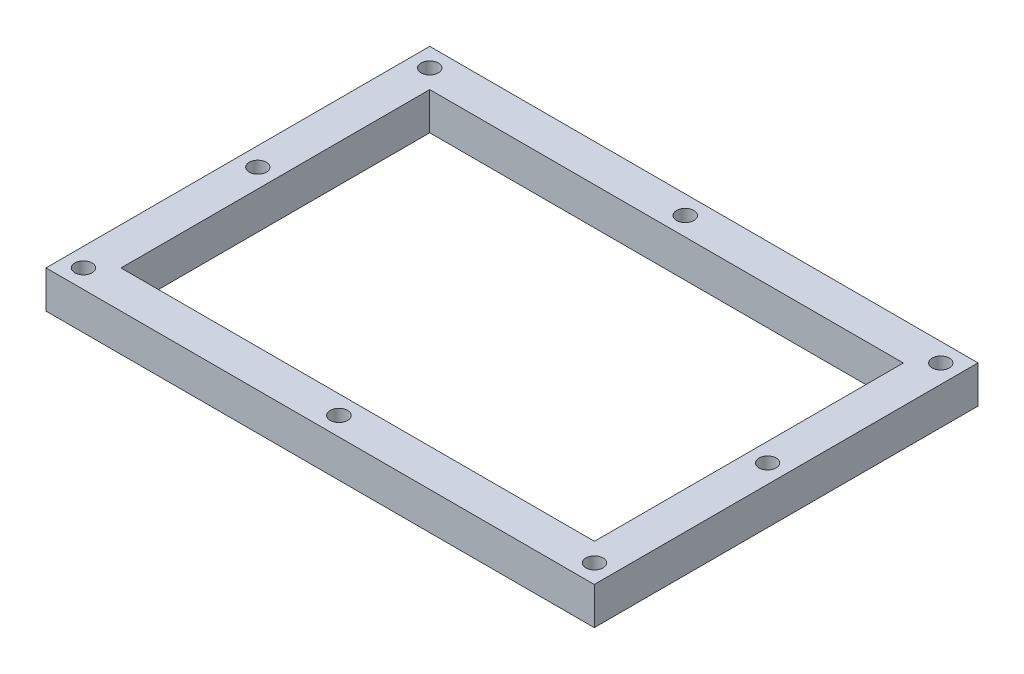
from build123d import *

# Parameters (mm, degrees)
SKETCH_1_W      = 146.451560669
SKETCH_1_H      = 102.5
SKETCH_1_R      = 2.329290182
SKETCH_1_R_2    = 2.3
EXTRUDE_1_DEPTH = 10


with BuildPart() as part:
    # Эскиз1 → Бобышка-Вытянуть1 (new body)
    with BuildSketch(Plane(origin=(0, 236.195974268, 0), x_dir=(1, 0, 0), z_dir=(0, 1, 0))):
        with Locations((64.784761029, -89.523129836)):
            Rectangle(SKETCH_1_W, SKETCH_1_H)
        with Locations(Location((64.808980694, -43.273129836, 0), (0, 0, 180))):
            Circle(SKETCH_1_R, mode=Mode.SUBTRACT)
        with Locations(Location((-3.441019306, -89.187817333, 0), (0, 0, 180))):
            Circle(SKETCH_1_R_2, mode=Mode.SUBTRACT)
        with Locations(Location((64.808980694, -135.773129836, 0), (0, 0, 180))):
            Circle(SKETCH_1_R, mode=Mode.SUBTRACT)
        with Locations(Location((133.058980694, -89.523129836, 0), (0, 0, 180))):
            Circle(SKETCH_1_R_2, mode=Mode.SUBTRACT)
        with Locations(Location((-3.441019306, -43.273129836, 0), (0, 0, 180))):
            Circle(SKETCH_1_R_2, mode=Mode.SUBTRACT)
        with Locations(Location((133.058980694, -43.273129836, 0), (0, 0, 180))):
            Circle(SKETCH_1_R_2, mode=Mode.SUBTRACT)
        with Locations(Location((133.058980694, -135.773129836, 0), (0, 0, 180))):
            Circle(SKETCH_1_R_2, mode=Mode.SUBTRACT)
        with Locations(Location((-3.441019306, -135.773129836, 0), (0, 0, 180))):
            Circle(SKETCH_1_R_2, mode=Mode.SUBTRACT)
        Polygon((1.591962046, -130.773129836), (1.558980694, -48.273129836), (128.058980694, -48.273129836), (128.058980694, -130.773129836), align=None, mode=Mode.SUBTRACT)
    extrude(amount=EXTRUDE_1_DEPTH)


solid = part.part
